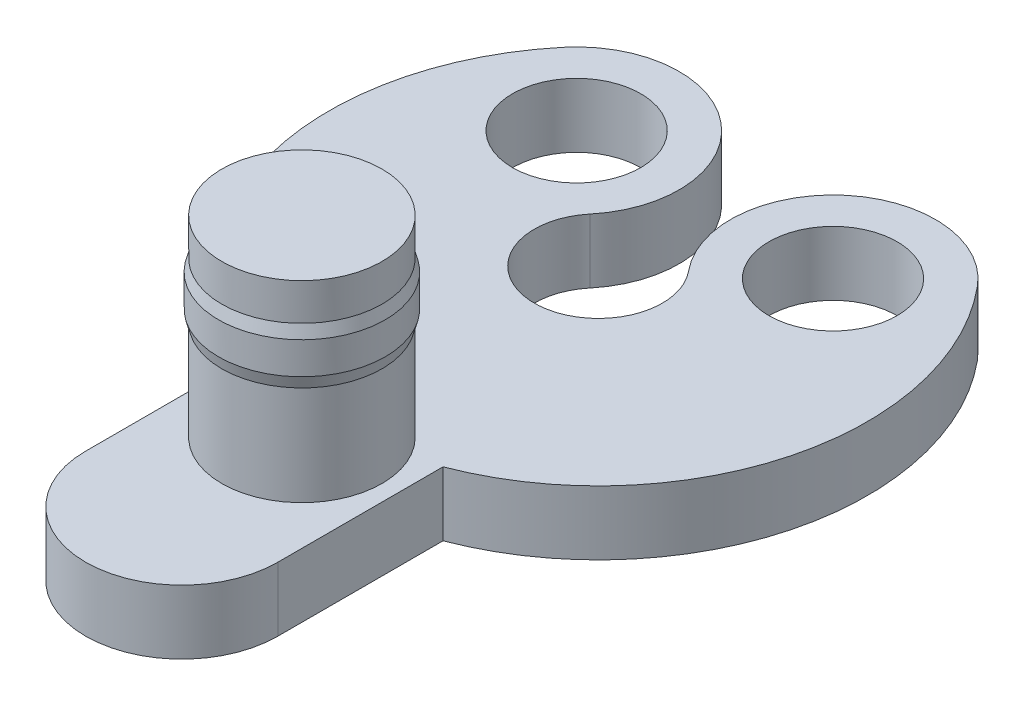
from build123d import *

# Parameters (mm, degrees)
SKETCH_1_R      = 2
EXTRUDE_1_DEPTH = 2
SKETCH_2_R      = 2.5
EXTRUDE_2_DEPTH = 8


with BuildPart() as part:
    # 草图1 → 凸台-拉伸1 (new body)
    with BuildSketch(Plane(origin=(0, 0, 0), x_dir=(1, 0, 0), z_dir=(0, 1, 0))):
        with BuildLine():
            Line((3, -7.846018098), (3, -13))
            ThreePointArc((3, -13), (0, -16), (-3, -13))
            Line((-3, -13), (-3, -7.846018098))
            ThreePointArc((-3, -7.846018098), (-8.125792122, -2.128732579), (-6.461538462, 5.367356958))
            ThreePointArc((-6.461538462, 5.367356958), (-1.955292588, 5.784188007), (-1.538461538, 1.277942133))
            ThreePointArc((-1.538461538, 1.277942133), (0, -2), (1.538461538, 1.277942133))
            ThreePointArc((1.538461538, 1.277942133), (1.955292588, 5.784188007), (6.461538462, 5.367356958))
            ThreePointArc((6.461538462, 5.367356958), (8.125792122, -2.128732579), (3, -7.846018098))
        make_face()
        with Locations(Location((-4, 3.322649545, 0), (0, 0, 270))):
            Circle(SKETCH_1_R, mode=Mode.SUBTRACT)
        with Locations(Location((4, 3.322649545, 0), (0, 0, 270))):
            Circle(SKETCH_1_R, mode=Mode.SUBTRACT)
    extrude(amount=EXTRUDE_1_DEPTH)

    # 草图2 → 凸台-拉伸2 (add)
    with BuildSketch(Plane.XZ):
        with Locations(Location((0, 9.25, 0), (0, 0, 270))):
            Circle(SKETCH_2_R)
    extrude(amount=-EXTRUDE_2_DEPTH)

    # 草图7 → 旋转3 (revolve)
    with BuildSketch(Plane(origin=(0, 0, 11.498467043), x_dir=(0, 0, 1), z_dir=(-1, 0, 0)), mode=Mode.PRIVATE) as revolve_3_sk:
        Polygon((-2.248467043, 5.1), (0.251532957, 5.1), (0.351532957, 5.473205081), (0.351532957, 6.473205081), (0.251532957, 6.846410162), (-2.248467043, 6.846410162), align=None)
    revolve(revolve_3_sk.sketch.rotate(Axis((0, 2, 9.25), (0, 1, 0)), 180), axis=Axis((0, 2, 9.25), (0, 1, 0)))


solid = part.part
